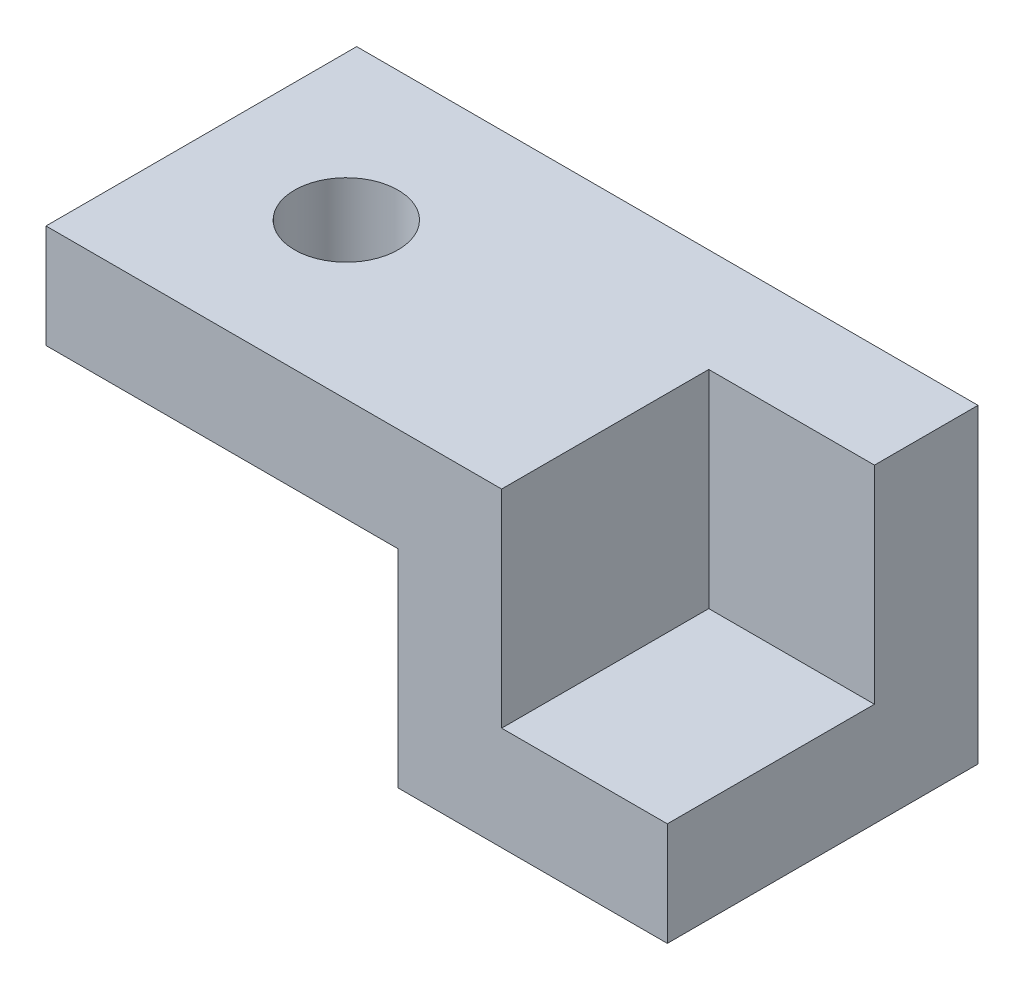
from build123d import *

# Parameters (mm, degrees)
BOSS_EXTRUDE1_START = 50
SKETCH1_W           = 85
SKETCH1_H           = 75
SKETCH1_R           = 12.5
BOSS_EXTRUDE1_DEPTH = 25
BOSS_EXTRUDE2_DEPTH = 75
SKETCH1_4_W         = 40
SKETCH1_4_H         = 50
BOSS_EXTRUDE3_DEPTH = 25


with BuildPart() as part:
    # Sketch1 → Boss-Extrude1 (new body)
    with BuildSketch(Plane(origin=(0, 0, 0), x_dir=(1, 0, 0), z_dir=(0, 1, 0)).offset(BOSS_EXTRUDE1_START)):
        with Locations((-107.5, -37.5)):
            Rectangle(SKETCH1_W, SKETCH1_H)
        with Locations((-115, -37.5)):
            Circle(SKETCH1_R, mode=Mode.SUBTRACT)
    extrude(amount=BOSS_EXTRUDE1_DEPTH)

    # Sketch1<3> → Boss-Extrude2 (add)
    with BuildSketch(Plane(origin=(0, 0, 0), x_dir=(1, 0, 0), z_dir=(0, 1, 0))):
        Polygon((-40, -25), (0, -25), (0, 0), (-65, 0), (-65, -75), (-40, -75), align=None)
    extrude(amount=BOSS_EXTRUDE2_DEPTH)

    # Sketch1<4> → Boss-Extrude3 (add)
    with BuildSketch(Plane(origin=(0, 0, 0), x_dir=(1, 0, 0), z_dir=(0, 1, 0))):
        with Locations((-20, -50)):
            Rectangle(SKETCH1_4_W, SKETCH1_4_H)
    extrude(amount=BOSS_EXTRUDE3_DEPTH)


solid = part.part
